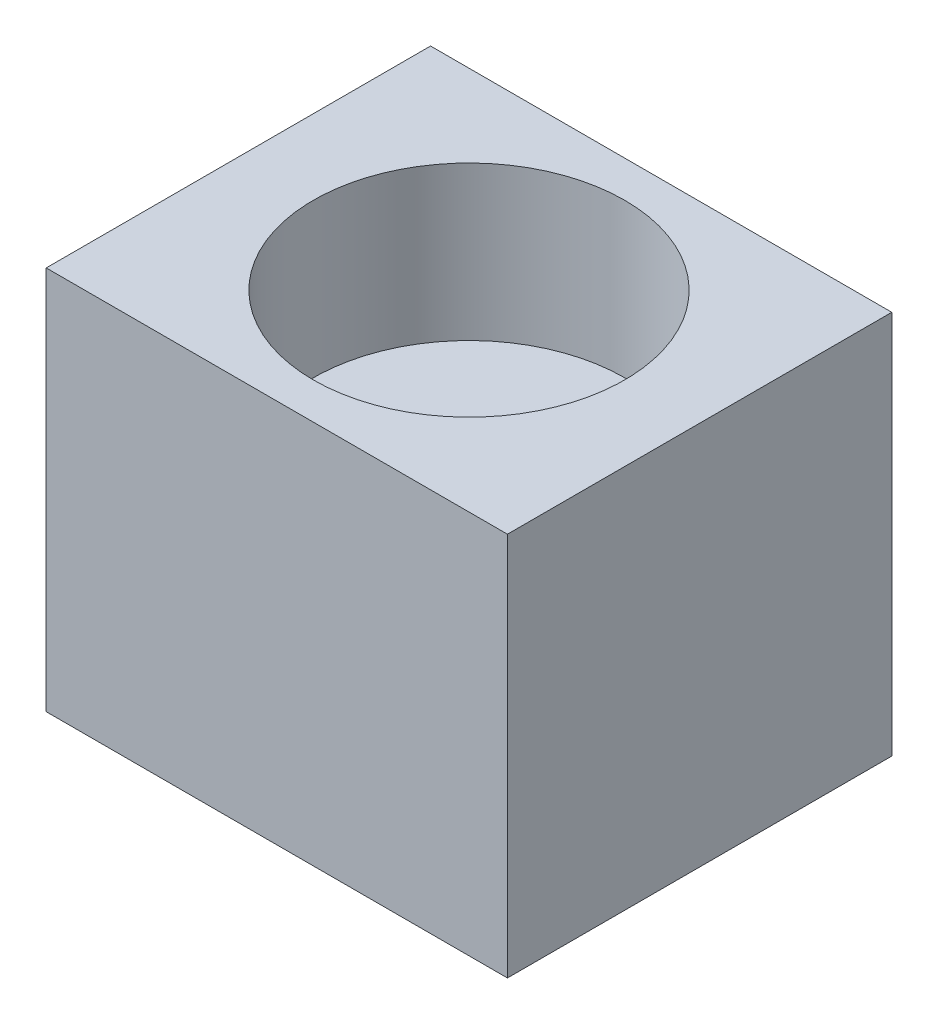
from build123d import *

# Parameters (mm, degrees)
SKETCH1_W           = 60
SKETCH1_H           = 50
BOSS_EXTRUDE2_DEPTH = 50
SKETCH4_R           = 20.25
CUT_EXTRUDE1_DEPTH  = 20


with BuildPart() as part:
    # Sketch1 → Boss-Extrude2 (new body)
    with BuildSketch(Plane(origin=(0, 0, 0), x_dir=(1, 0, 0), z_dir=(0, 1, 0))):
        Rectangle(SKETCH1_W, SKETCH1_H)
    extrude(amount=BOSS_EXTRUDE2_DEPTH)

    # Sketch4 → Cut-Extrude1 (cut)
    with BuildSketch(Plane(origin=(0, 50, 0), x_dir=(1, 0, 0), z_dir=(0, 1, 0))):
        with Locations(Location((0, 0, 0), (0, 0, 270))):
            Circle(SKETCH4_R)
    extrude(amount=-CUT_EXTRUDE1_DEPTH, mode=Mode.SUBTRACT)


solid = part.part
